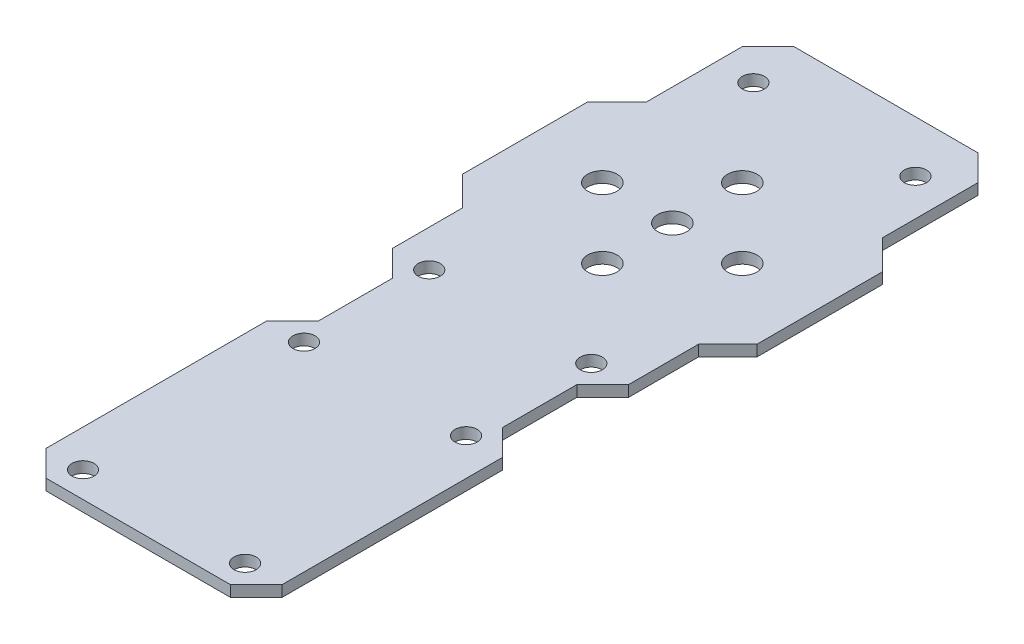
from build123d import *

# Parameters (mm, degrees)
SKETCH_1_R      = 2
SKETCH_1_R_2    = 1.5
EXTRUDE_1_DEPTH = 1.5


with BuildPart() as part:
    # 草图1 → 凸台-拉伸1 (new body)
    with BuildSketch(Plane(origin=(0, 0, 0), x_dir=(1, 0, 0), z_dir=(0, 1, 0))):
        Polygon((19.989240701, 17.010759299), (19.989240701, 34.032277896), (15.994131292, 38.027387305), (15.994131292, 51.001956236), (12.496087528, 54.5), (-12.496087528, 54.5), (-15.994131292, 51.001956236), (-15.994131292, 38.027387305), (-19.989240701, 34.032277896), (-19.989240701, 17.010759299), (-16.021518597, 13.043037194), (-16.021518597, 3.543037194), (-12.510759299, 0.032277896), (-12.510759299, -10.032277896), (-16.021518597, -13.543037194), (-16.021518597, -43.5), (-12.521518597, -47), (12.521518597, -47), (16.021518597, -43.5), (16.021518597, -13.543037194), (12.510759299, -10.032277896), (12.510759299, 0.032277896), (16.021518597, 3.543037194), (16.021518597, 13.043037194), align=None)
        with Locations(Location((0, 25.5, 0), (0, 0, 270))):
            Circle(SKETCH_1_R, mode=Mode.SUBTRACT)
        with Locations(Location((9.5, 25.5, 0), (0, 0, 270))):
            Circle(SKETCH_1_R, mode=Mode.SUBTRACT)
        with Locations(Location((11, 3.5, 0), (0, 0, 270))):
            Circle(SKETCH_1_R_2, mode=Mode.SUBTRACT)
        with Locations(Location((11, 47.5, 0), (0, 0, 270))):
            Circle(SKETCH_1_R_2, mode=Mode.SUBTRACT)
        with Locations(Location((-11, 47.5, 0), (0, 0, 90))):
            Circle(SKETCH_1_R_2, mode=Mode.SUBTRACT)
        with Locations(Location((-11, 3.5, 0), (0, 0, 90))):
            Circle(SKETCH_1_R_2, mode=Mode.SUBTRACT)
        with Locations(Location((11, -13.5, 0), (0, 0, 270))):
            Circle(SKETCH_1_R_2, mode=Mode.SUBTRACT)
        with Locations(Location((11, -43.5, 0), (0, 0, 270))):
            Circle(SKETCH_1_R_2, mode=Mode.SUBTRACT)
        with Locations(Location((-11, -13.5, 0), (0, 0, 90))):
            Circle(SKETCH_1_R_2, mode=Mode.SUBTRACT)
        with Locations(Location((-11, -43.5, 0), (0, 0, 90))):
            Circle(SKETCH_1_R_2, mode=Mode.SUBTRACT)
        with Locations(Location((0, 16, 0), (0, 0, 270))):
            Circle(SKETCH_1_R, mode=Mode.SUBTRACT)
        with Locations(Location((-9.5, 25.5, 0), (0, 0, 270))):
            Circle(SKETCH_1_R, mode=Mode.SUBTRACT)
        with Locations(Location((0, 35, 0), (0, 0, 270))):
            Circle(SKETCH_1_R, mode=Mode.SUBTRACT)
    extrude(amount=EXTRUDE_1_DEPTH)


solid = part.part
